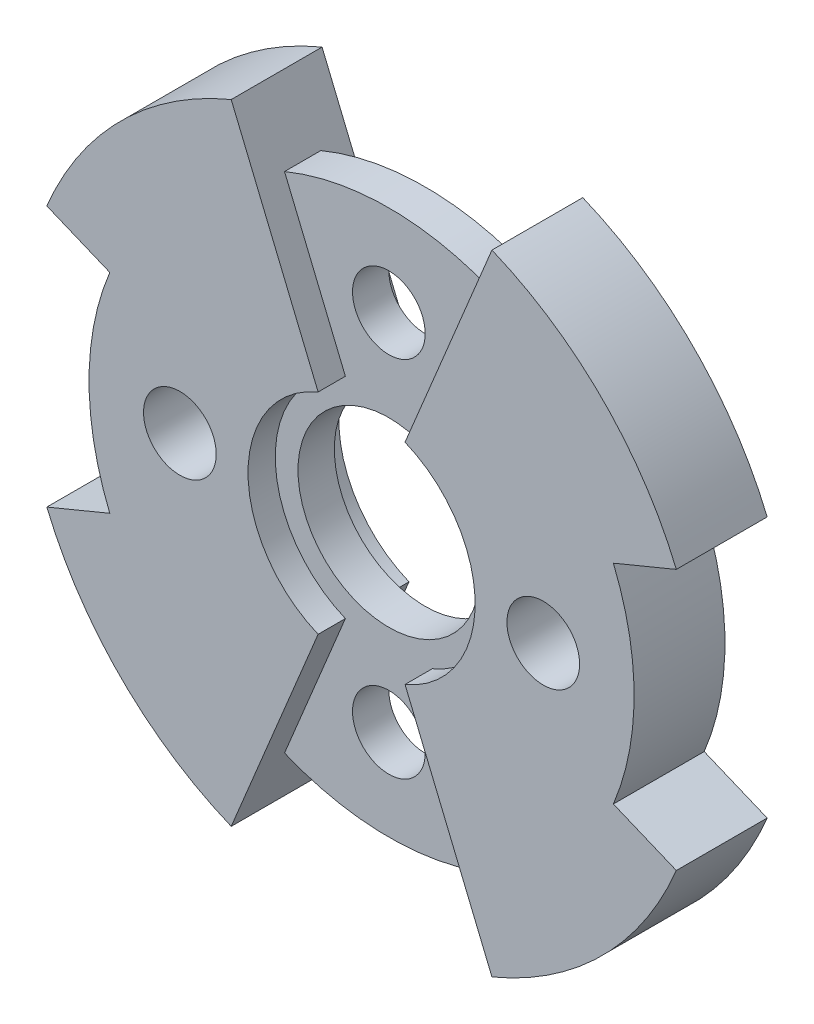
from build123d import *

# Parameters (mm, degrees)
SKETCH1_R             = 8
BOSS_EXTRUDE1_DEPTH   = 10
BOSS_EXTRUDE1_2_DEPTH = 10
SKETCH1_3_R           = 20
SKETCH1_3_R_2         = 8
BOSS_EXTRUDE2_DEPTH   = 4


with BuildPart() as part:
    # Sketch1 → Boss-Extrude1 (new, symmetric)
    with BuildSketch(Plane.XY):
        with BuildLine():
            ThreePointArc((9.567085809, 23.096988313), (25, 0), (9.567085809, -23.096988313))
            Line((9.567085809, -23.096988313), (28.701257427, -69.290964938))
            ThreePointArc((28.701257427, -69.290964938), (53.033008589, -53.033008589), (69.290964938, -28.701257427))
            Line((69.290964938, -28.701257427), (55.432771951, -22.961005942))
            ThreePointArc((55.432771951, -22.961005942), (60, 0), (55.432771951, 22.961005942))
            Line((55.432771951, 22.961005942), (69.290964938, 28.701257427))
            ThreePointArc((69.290964938, 28.701257427), (53.033008589, 53.033008589), (28.701257427, 69.290964938))
            Line((28.701257427, 69.290964938), (9.567085809, 23.096988313))
        make_face()
        with Locations((40, 0)):
            Circle(SKETCH1_R, mode=Mode.SUBTRACT)
    extrude(amount=BOSS_EXTRUDE1_DEPTH, both=True)



with BuildPart() as body_2:
    # Sketch1 → Boss-Extrude1 2 (new, symmetric)
    with BuildSketch(Plane.XY):
        with BuildLine():
            Line((-9.567085809, 23.096988313), (-28.701257427, 69.290964938))
            ThreePointArc((-28.701257427, 69.290964938), (-53.033008589, 53.033008589), (-69.290964938, 28.701257427))
            Line((-69.290964938, 28.701257427), (-55.432771951, 22.961005942))
            ThreePointArc((-55.432771951, 22.961005942), (-60, 0), (-55.432771951, -22.961005942))
            Line((-55.432771951, -22.961005942), (-69.290964938, -28.701257427))
            ThreePointArc((-69.290964938, -28.701257427), (-53.033008589, -53.033008589), (-28.701257427, -69.290964938))
            Line((-28.701257427, -69.290964938), (-9.567085809, -23.096988313))
            ThreePointArc((-9.567085809, -23.096988313), (-25, 0), (-9.567085809, 23.096988313))
        make_face()
        with Locations((-40, 0)):
            Circle(SKETCH1_R, mode=Mode.SUBTRACT)
    extrude(amount=BOSS_EXTRUDE1_2_DEPTH, both=True)


with BuildPart() as part_1:
    add(part.part)

    add(body_2.part)  # Boss-Extrude2 merges body 2
    # Sketch1<3> → Boss-Extrude2 (add, symmetric)
    with BuildSketch(Plane.XY):
        with BuildLine():
            ThreePointArc((-9.567085809, 23.096988313), (-25, 0), (-9.567085809, -23.096988313))
            Line((-9.567085809, -23.096988313), (-22.961005942, -55.432771951))
            ThreePointArc((-22.961005942, -55.432771951), (0, -60), (22.961005942, -55.432771951))
            Line((22.961005942, -55.432771951), (9.567085809, -23.096988313))
            ThreePointArc((9.567085809, -23.096988313), (25, 0), (9.567085809, 23.096988313))
            Line((9.567085809, 23.096988313), (22.961005942, 55.432771951))
            ThreePointArc((22.961005942, 55.432771951), (0, 60), (-22.961005942, 55.432771951))
            Line((-22.961005942, 55.432771951), (-9.567085809, 23.096988313))
        make_face()
        Circle(SKETCH1_3_R, mode=Mode.SUBTRACT)
        with Locations((0, 40)):
            Circle(SKETCH1_3_R_2, mode=Mode.SUBTRACT)
        with Locations((0, -40)):
            Circle(SKETCH1_3_R_2, mode=Mode.SUBTRACT)
    extrude(amount=BOSS_EXTRUDE2_DEPTH, both=True)


solid = part_1.part
